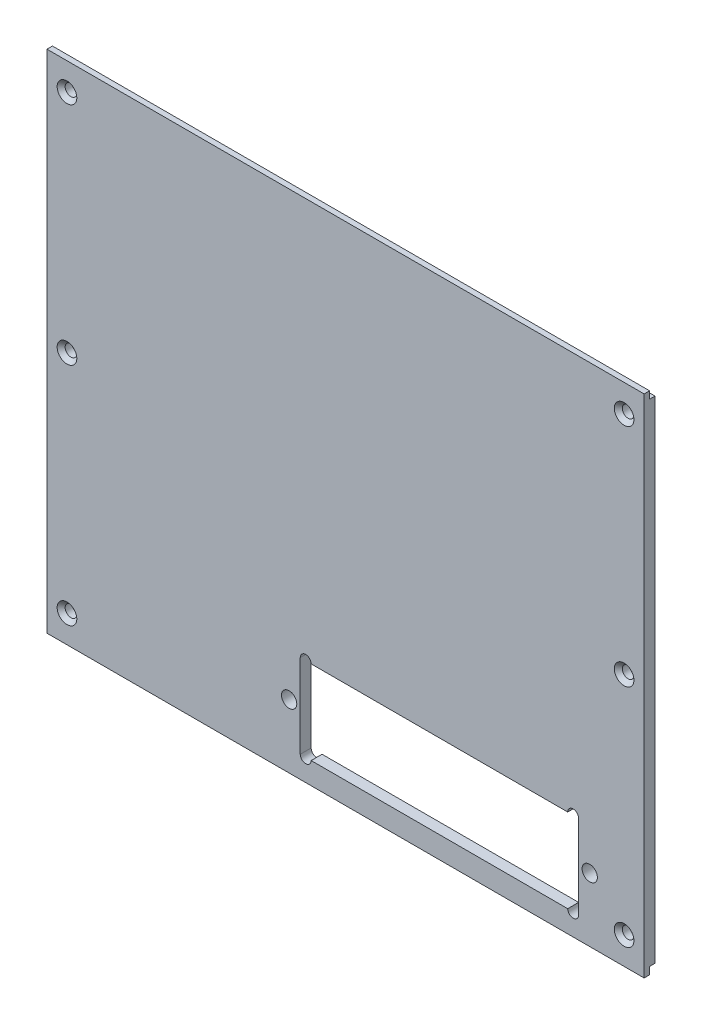
from build123d import *

# Parameters (mm, degrees)
SKETCH1_W                                         = 164.1
SKETCH1_H                                         = 139
BOSS_EXTRUDE1_DEPTH                               = 3
CSK_FOR_4_FLAT_HEAD_MACHINE_SCREW_100_D           = 3.19999995
CSK_FOR_4_FLAT_HEAD_MACHINE_SCREW_100_CSINK_D     = 5.400000122
CSK_FOR_4_FLAT_HEAD_MACHINE_SCREW_100_CSINK_ANGLE = 90
CUT_EXTRUDE1_REACH                                = 109.571
SKETCH4_R                                         = 2.1
SKETCH4_W                                         = 76.5
SKETCH4_H                                         = 23
CUT_EXTRUDE2_START                                = -3
CUT_EXTRUDE2_DEPTH                                = 3
SKETCH6_W                                         = 164.1
SKETCH6_H                                         = 2
CUT_EXTRUDE3_DEPTH                                = 1.5


with BuildPart() as part:
    # Sketch1 → Boss-Extrude1 (new body)
    with BuildSketch(Plane.XY):
        Rectangle(SKETCH1_W, SKETCH1_H)
    extrude(amount=BOSS_EXTRUDE1_DEPTH)

    # CSK for #4 Flat Head Machine Screw (100)1 (through all)
    with Locations(Plane.XY.offset(3)):
        with Locations((-76.55, 62), (-76.55, 0), (-76.55, -62), (76.55, -62), (76.55, 0), (76.55, 62)):
            CounterSinkHole(CSK_FOR_4_FLAT_HEAD_MACHINE_SCREW_100_D / 2, CSK_FOR_4_FLAT_HEAD_MACHINE_SCREW_100_CSINK_D / 2, counter_sink_angle=CSK_FOR_4_FLAT_HEAD_MACHINE_SCREW_100_CSINK_ANGLE)

    # Sketch4 → Cut-Extrude1 (cut, up to next)
    with BuildSketch(Plane.XY.offset(3), mode=Mode.PRIVATE) as cut_extrude1_sk1:
        with Locations((-15.5, -52)):
            Circle(SKETCH4_R)
    cut_extrude1_tool1 = extrude(cut_extrude1_sk1.sketch, amount=-CUT_EXTRUDE1_REACH, mode=Mode.PRIVATE) & part.part
    # Sketch4 → Cut-Extrude1 (cut, up to next)
    with BuildSketch(Plane.XY.offset(3), mode=Mode.PRIVATE) as cut_extrude1_sk2:
        with Locations((67.1, -52)):
            Circle(SKETCH4_R)
    cut_extrude1_tool2 = extrude(cut_extrude1_sk2.sketch, amount=-CUT_EXTRUDE1_REACH, mode=Mode.PRIVATE) & part.part
    # Sketch4 → Cut-Extrude1 (cut, up to next)
    with BuildSketch(Plane.XY.offset(3), mode=Mode.PRIVATE) as cut_extrude1_sk3:
        with Locations((25.8, -52)):
            Rectangle(SKETCH4_W, SKETCH4_H)
    cut_extrude1_tool3 = extrude(cut_extrude1_sk3.sketch, amount=-CUT_EXTRUDE1_REACH, mode=Mode.PRIVATE) & part.part
    add(cut_extrude1_tool1.solids().sort_by_distance((-15.5, -52, 3))[0], mode=Mode.SUBTRACT)
    add(cut_extrude1_tool2.solids().sort_by_distance((67.1, -52, 3))[0], mode=Mode.SUBTRACT)
    add(cut_extrude1_tool3.solids().sort_by_distance((25.8, -52, 3))[0], mode=Mode.SUBTRACT)

    # Sketch5 → Cut-Extrude2 (cut)
    with BuildSketch(Plane.XY.offset(3).offset(CUT_EXTRUDE2_START)):
        with BuildLine():
            Line((-12.45, -63.5), (-12.45, -40.5))
            ThreePointArc((-12.45, -40.5), (-10.95, -39), (-9.45, -40.5))
            Line((-9.45, -40.5), (-9.45, -63.5))
            ThreePointArc((-9.45, -63.5), (-10.95, -65), (-12.45, -63.5))
        make_face()
        with BuildLine():
            Line((64.05, -63.5), (64.05, -40.5))
            ThreePointArc((64.05, -40.5), (62.55, -39), (61.05, -40.5))
            Line((61.05, -40.5), (61.05, -63.5))
            ThreePointArc((61.05, -63.5), (62.55, -65), (64.05, -63.5))
        make_face()
    extrude(amount=CUT_EXTRUDE2_DEPTH, mode=Mode.SUBTRACT)

    # Sketch6 → Cut-Extrude3 (cut)
    with BuildSketch(Plane(origin=(0, 0, 0), x_dir=(-1, 0, 0), z_dir=(0, 0, -1))):
        with Locations((0, 68.5)):
            Rectangle(SKETCH6_W, SKETCH6_H)
        with Locations((0, -68.5)):
            Rectangle(SKETCH6_W, SKETCH6_H)
    extrude(amount=-CUT_EXTRUDE3_DEPTH, mode=Mode.SUBTRACT)


solid = part.part
